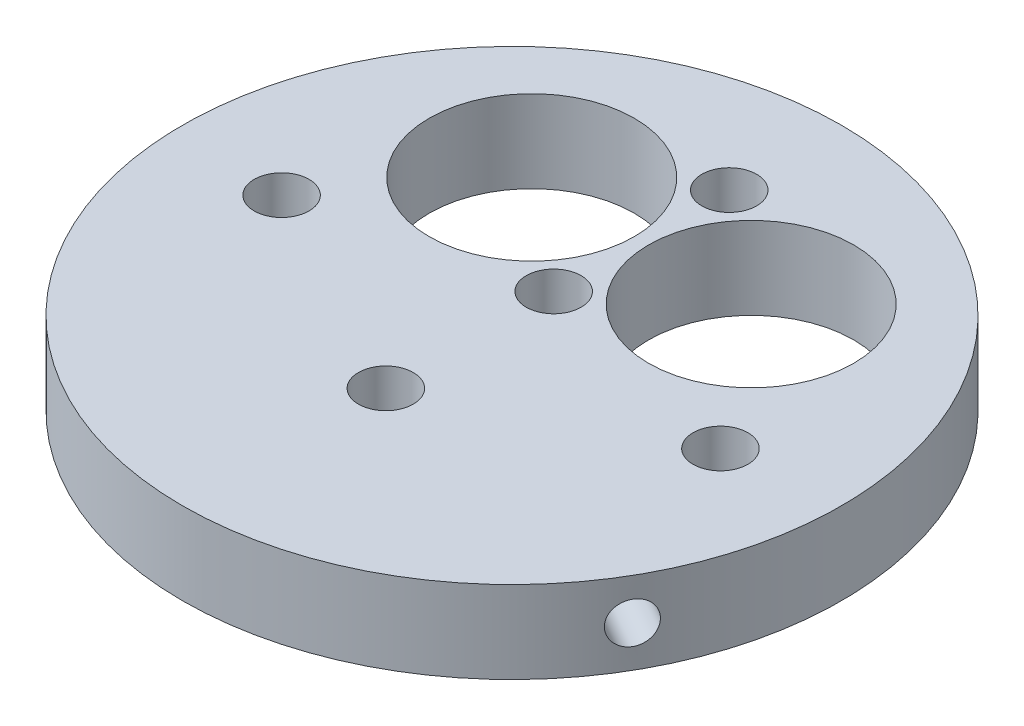
from build123d import *

# Parameters (mm, degrees)
SKETCH1_W               = 38.1508
SKETCH1_H               = 9.525
CUT_EXTRUDE1_DEPTH      = 55.787705795
CUT_EXTRUDE1_DEPTH_BACK = 55.787705795
SKETCH2_R               = 11.8745
SKETCH2_R_2             = 3.175
CUT_EXTRUDE2_DEPTH      = 55.787705795
CUT_EXTRUDE2_DEPTH_BACK = 55.787705795
SKETCH3_R               = 3.175
SKETCH4_R               = 2.3749
CUT_EXTRUDE3_DEPTH      = 6.35
CIRPATTERN1_COUNT       = 3


with BuildPart() as part:
    # Sketch1 → Revolve1 (revolve)
    with BuildSketch(Plane.XY):
        with Locations((19.0754, 4.7625)):
            Rectangle(SKETCH1_W, SKETCH1_H)
    revolve(axis=Axis((0, 0, 0), (0, 1, 0)))

    # Sketch2 → Cut-Extrude1 (cut, two sides: drawn at the far end of the back side and taken through both)
    with BuildSketch(Plane(origin=(0, 9.525, 0), x_dir=(1, 0, 0), z_dir=(0, 1, 0)).offset(-CUT_EXTRUDE1_DEPTH_BACK)):
        with Locations((-12.7, 14.986)):
            Circle(SKETCH2_R)
        with Locations((12.7, 14.986)):
            Circle(SKETCH2_R)
        with Locations((0, 25.146)):
            Circle(SKETCH2_R_2)
        with Locations((0, 4.826)):
            Circle(SKETCH2_R_2)
        with Locations((0, -14.605)):
            Circle(SKETCH2_R_2)
    extrude(amount=CUT_EXTRUDE1_DEPTH + CUT_EXTRUDE1_DEPTH_BACK, mode=Mode.SUBTRACT)

    # Sketch3 → Cut-Extrude2 (cut, two sides: drawn at the far end of the back side and taken through both)
    with BuildSketch(Plane(origin=(0, 9.525, 0), x_dir=(1, 0, 0), z_dir=(0, 1, 0)).offset(-CUT_EXTRUDE2_DEPTH_BACK)):
        with Locations((-25.4, -1.27)):
            Circle(SKETCH3_R)
        with Locations((25.4, -1.27)):
            Circle(SKETCH3_R)
    extrude(amount=CUT_EXTRUDE2_DEPTH + CUT_EXTRUDE2_DEPTH_BACK, mode=Mode.SUBTRACT)

    # Sketch4 → Cut-Extrude3 (cut)
    with BuildSketch(Plane(origin=(33.039561975, 0, 19.0754), x_dir=(0, -1, 0), z_dir=(0.866025403784438, 0, 0.500000000000001))):
        with Locations((-4.7625, 0)):
            Circle(SKETCH4_R)
    cut_extrude3 = extrude(amount=-CUT_EXTRUDE3_DEPTH, mode=Mode.SUBTRACT)

    # CirPattern1: Cut-Extrude3 ×3 about axis
    cirpattern1_axis = Axis((0, 55, 0), (0, -1, 0))
    for i in range(1, CIRPATTERN1_COUNT):
        add(cut_extrude3.rotate(cirpattern1_axis, i * 360 / CIRPATTERN1_COUNT), mode=Mode.SUBTRACT)


solid = part.part
